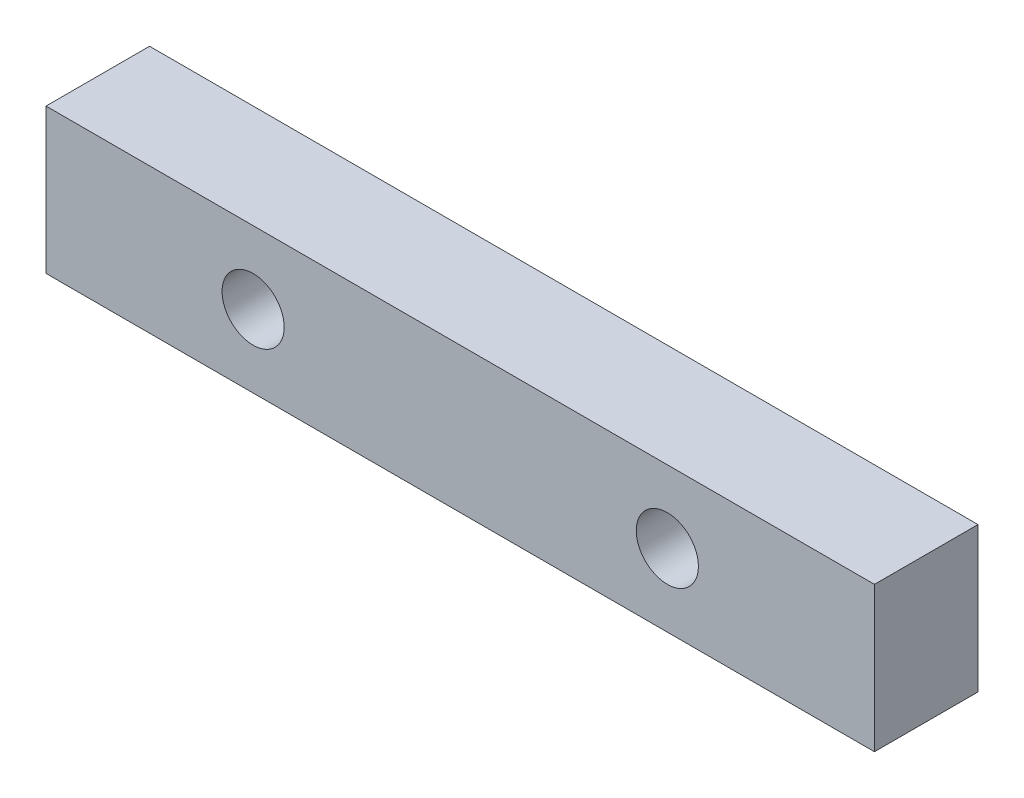
from build123d import *

# Parameters (mm, degrees)
SKIZZE1_W                       = 40
SKIZZE1_H                       = 7
SKIZZE1_R                       = 1.5
AUFSATZ_LINEAR_AUSTRAGEN1_DEPTH = 5


with BuildPart() as part:
    # Skizze1 → Aufsatz-Linear austragen1 (new body)
    with BuildSketch(Plane.XY):
        Rectangle(SKIZZE1_W, SKIZZE1_H)
        with Locations((-10, 0)):
            Circle(SKIZZE1_R, mode=Mode.SUBTRACT)
        with Locations((10, 0)):
            Circle(SKIZZE1_R, mode=Mode.SUBTRACT)
    extrude(amount=AUFSATZ_LINEAR_AUSTRAGEN1_DEPTH)


solid = part.part
